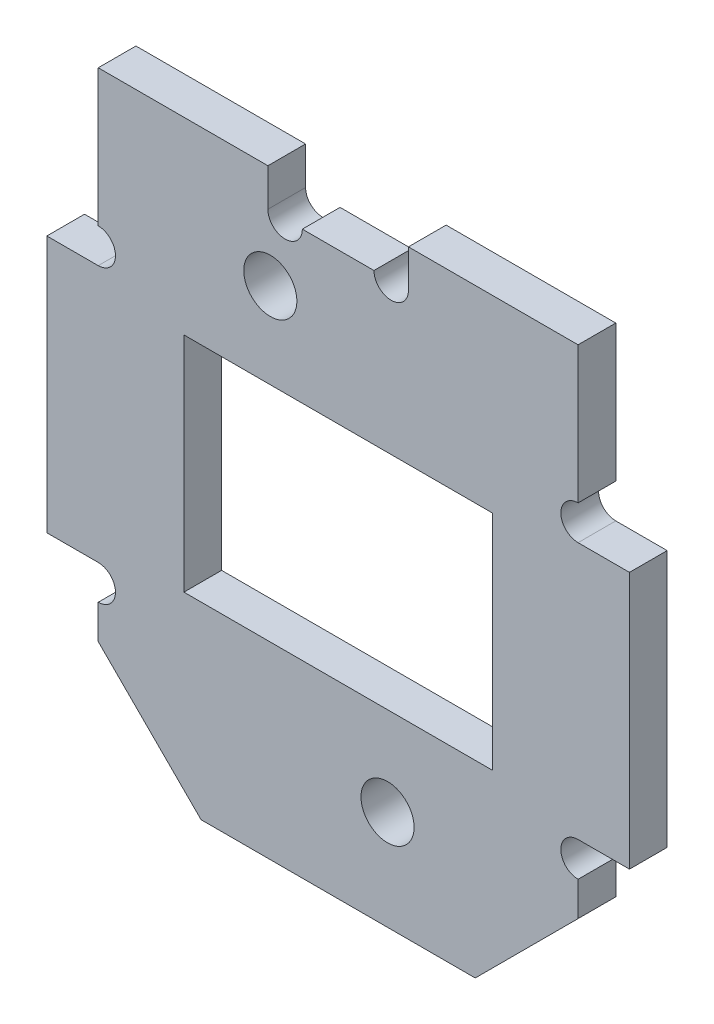
from build123d import *

# Parameters (mm, degrees)
SKETCH_1_R      = 1.55
SKETCH_1_W      = 18
SKETCH_1_H      = 13
EXTRUDE_1_DEPTH = 2.2
CHAMFER_1_SIZE  = 6


with BuildPart() as part:
    # 草图1 → 凸台-拉伸1 (new body)
    with BuildSketch(Plane.XY):
        with BuildLine():
            Line((-14, -17.5), (14, -17.5))
            Line((14, -17.5), (14, -9.51))
            ThreePointArc((14, -9.51), (12.995, -8.505), (14, -7.5))
            Line((14, -7.5), (17, -7.5))
            Line((17, -7.5), (17, 7.5))
            Line((17, 7.5), (14, 7.5))
            ThreePointArc((14, 7.5), (12.995, 8.505), (14, 9.51))
            Line((14, 9.51), (14, 17.5))
            Line((14, 17.5), (4.1, 17.5))
            Line((4.1, 17.5), (4.1, 15.3))
            ThreePointArc((4.1, 15.3), (3.095, 14.295), (2.09, 15.3))
            Line((2.09, 15.3), (-2.09, 15.3))
            ThreePointArc((-2.09, 15.3), (-3.095, 14.295), (-4.1, 15.3))
            Line((-4.1, 15.3), (-4.1, 17.5))
            Line((-4.1, 17.5), (-14, 17.5))
            Line((-14, 17.5), (-14, 9.51))
            ThreePointArc((-14, 9.51), (-13.289357685, 9.215642315), (-12.995, 8.505))
            ThreePointArc((-12.995, 8.505), (-13.289357685, 7.794357685), (-14, 7.5))
            Line((-14, 7.5), (-17, 7.5))
            Line((-17, 7.5), (-17, -7.5))
            Line((-17, -7.5), (-14, -7.5))
            ThreePointArc((-14, -7.5), (-13.289357685, -7.794357685), (-12.995, -8.505))
            ThreePointArc((-12.995, -8.505), (-13.289357685, -9.215642315), (-14, -9.51))
            Line((-14, -9.51), (-14, -17.5))
        make_face()
        with Locations((2.882843865, -11.677628522)):
            Circle(SKETCH_1_R, mode=Mode.SUBTRACT)
        Rectangle(SKETCH_1_W, SKETCH_1_H, mode=Mode.SUBTRACT)
        with Locations((-3.958028601, 11.5)):
            Circle(SKETCH_1_R, mode=Mode.SUBTRACT)
    extrude(amount=EXTRUDE_1_DEPTH)

    # 倒角1
    chamfer_1_edges = [part.edges().sort_by_distance(p)[0] for p in [
        (14, -17.5, 1.1),
        (-14, -17.5, 1.1),
    ]]
    chamfer(chamfer_1_edges, length=CHAMFER_1_SIZE)


solid = part.part
